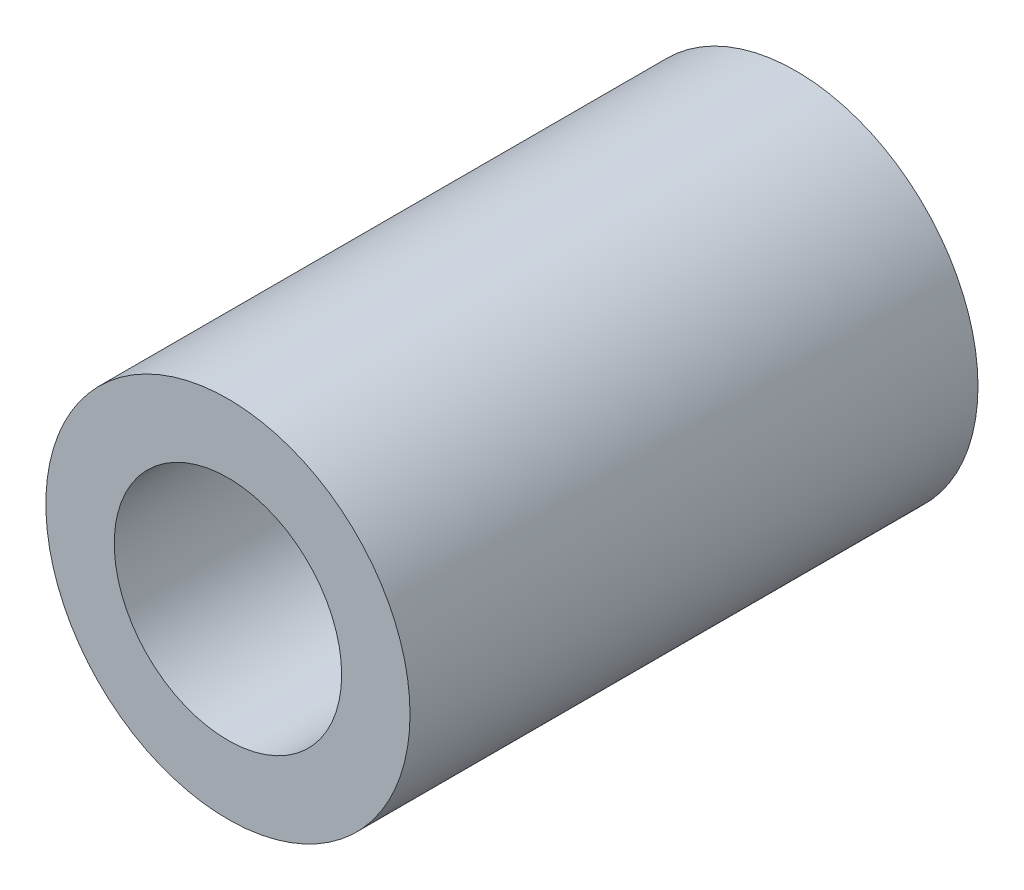
from build123d import *

# Parameters (mm, degrees)
SKETCH5_W = 25
SKETCH5_H = 3.01


with BuildPart() as part:
    # Sketch5 → Revolve1 (revolve)
    with BuildSketch(Plane(origin=(0, 0, 0), x_dir=(0, 0, -1), z_dir=(1, 0, 0))):
        with Locations((0, 6.51)):
            Rectangle(SKETCH5_W, SKETCH5_H)
    revolve(axis=Axis((0, 0, 12.5), (0, 0, -1)))


solid = part.part
